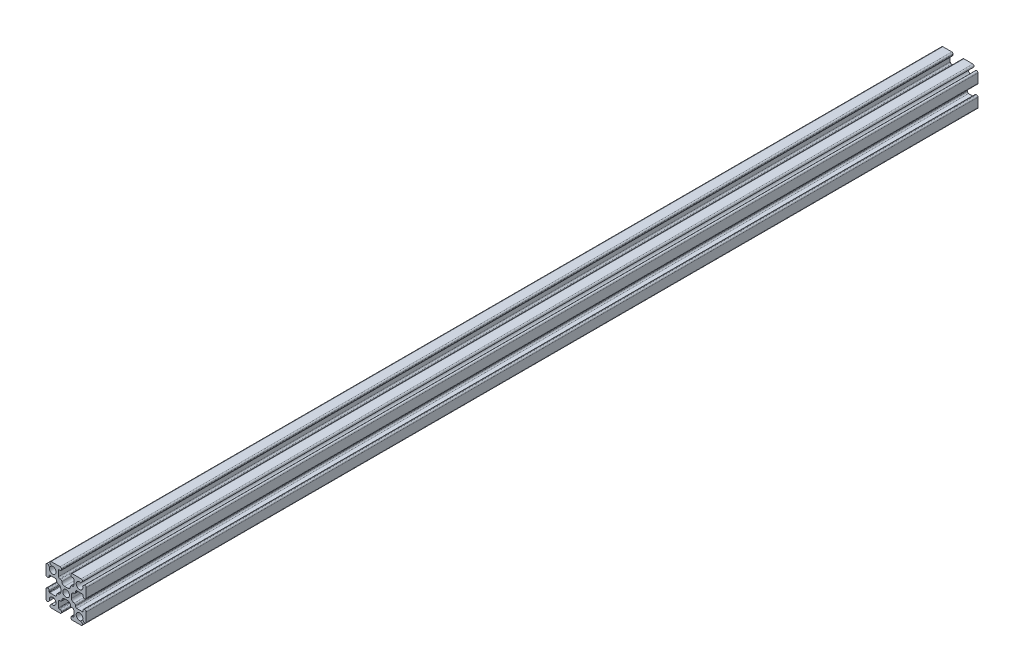
from build123d import *

# Parameters (mm, degrees)
SKETCH1_R           = 1.25
BOSS_EXTRUDE1_DEPTH = 332.35


with BuildPart() as part:
    # Sketch1 → Boss-Extrude1 (new body)
    with BuildSketch(Plane.XY):
        with BuildLine():
            Line((6.646446609, 5.939339828), (6.163645978, 5.456539197))
            ThreePointArc((6.163645978, 5.456539197), (4.116116524, 4.116116524), (5.456539197, 6.163645978))
            Line((5.456539197, 6.163645978), (5.939339828, 6.646446609))
            ThreePointArc((5.939339828, 6.646446609), (6.047726204, 7.191341716), (5.585786438, 7.5))
            Line((5.585786438, 7.5), (2.25, 7.5))
            ThreePointArc((2.25, 7.5), (1.896446609, 7.353553391), (1.75, 7))
            Line((1.75, 7), (1.75, 6.8))
            ThreePointArc((1.75, 6.8), (1.896446609, 6.446446609), (2.25, 6.3))
            Line((2.25, 6.3), (2.65, 6.3))
            ThreePointArc((2.65, 6.3), (2.791421356, 6.241421356), (2.85, 6.1))
            Line((2.85, 6.1), (2.85, 4))
            ThreePointArc((2.85, 4), (2.703553391, 3.646446609), (2.35, 3.5))
            Line((2.35, 3.5), (2.1, 3.5))
            ThreePointArc((2.1, 3.5), (1.746446609, 3.353553391), (1.6, 3))
            ThreePointArc((1.6, 3), (1.307106781, 2.292893219), (0.6, 2))
            Line((0.6, 2), (-0.6, 2))
            ThreePointArc((-0.6, 2), (-1.307106781, 2.292893219), (-1.6, 3))
            ThreePointArc((-1.6, 3), (-1.746446609, 3.353553391), (-2.1, 3.5))
            Line((-2.1, 3.5), (-2.35, 3.5))
            ThreePointArc((-2.35, 3.5), (-2.703553391, 3.646446609), (-2.85, 4))
            Line((-2.85, 4), (-2.85, 6.1))
            ThreePointArc((-2.85, 6.1), (-2.791421356, 6.241421356), (-2.65, 6.3))
            Line((-2.65, 6.3), (-2.25, 6.3))
            ThreePointArc((-2.25, 6.3), (-1.896446609, 6.446446609), (-1.75, 6.8))
            Line((-1.75, 6.8), (-1.75, 7))
            ThreePointArc((-1.75, 7), (-1.896446609, 7.353553391), (-2.25, 7.5))
            Line((-2.25, 7.5), (-5.585786438, 7.5))
            ThreePointArc((-5.585786438, 7.5), (-6.047726204, 7.191341716), (-5.939339828, 6.646446609))
            Line((-5.939339828, 6.646446609), (-5.456539197, 6.163645978))
            ThreePointArc((-5.456539197, 6.163645978), (-4.116116524, 4.116116524), (-6.163645978, 5.456539197))
            Line((-6.163645978, 5.456539197), (-6.646446609, 5.939339828))
            ThreePointArc((-6.646446609, 5.939339828), (-7.191341716, 6.047726204), (-7.5, 5.585786438))
            Line((-7.5, 5.585786438), (-7.5, 2.25))
            ThreePointArc((-7.5, 2.25), (-7.353553391, 1.896446609), (-7, 1.75))
            Line((-7, 1.75), (-6.8, 1.75))
            ThreePointArc((-6.8, 1.75), (-6.446446609, 1.896446609), (-6.3, 2.25))
            Line((-6.3, 2.25), (-6.3, 2.65))
            ThreePointArc((-6.3, 2.65), (-6.241421356, 2.791421356), (-6.1, 2.85))
            Line((-6.1, 2.85), (-4, 2.85))
            ThreePointArc((-4, 2.85), (-3.646446609, 2.703553391), (-3.5, 2.35))
            Line((-3.5, 2.35), (-3.5, 2.1))
            ThreePointArc((-3.5, 2.1), (-3.353553391, 1.746446609), (-3, 1.6))
            ThreePointArc((-3, 1.6), (-2.292893219, 1.307106781), (-2, 0.6))
            Line((-2, 0.6), (-2, -0.6))
            ThreePointArc((-2, -0.6), (-2.292893219, -1.307106781), (-3, -1.6))
            ThreePointArc((-3, -1.6), (-3.353553391, -1.746446609), (-3.5, -2.1))
            Line((-3.5, -2.1), (-3.5, -2.35))
            ThreePointArc((-3.5, -2.35), (-3.646446609, -2.703553391), (-4, -2.85))
            Line((-4, -2.85), (-6.1, -2.85))
            ThreePointArc((-6.1, -2.85), (-6.241421356, -2.791421356), (-6.3, -2.65))
            Line((-6.3, -2.65), (-6.3, -2.25))
            ThreePointArc((-6.3, -2.25), (-6.446446609, -1.896446609), (-6.8, -1.75))
            Line((-6.8, -1.75), (-7, -1.75))
            ThreePointArc((-7, -1.75), (-7.353553391, -1.896446609), (-7.5, -2.25))
            Line((-7.5, -2.25), (-7.5, -5.585786438))
            ThreePointArc((-7.5, -5.585786438), (-7.191341716, -6.047726204), (-6.646446609, -5.939339828))
            Line((-6.646446609, -5.939339828), (-6.163645978, -5.456539197))
            ThreePointArc((-6.163645978, -5.456539197), (-4.116116524, -4.116116524), (-5.456539197, -6.163645978))
            Line((-5.456539197, -6.163645978), (-5.939339828, -6.646446609))
            ThreePointArc((-5.939339828, -6.646446609), (-6.047726204, -7.191341716), (-5.585786438, -7.5))
            Line((-5.585786438, -7.5), (-2.25, -7.5))
            ThreePointArc((-2.25, -7.5), (-1.896446609, -7.353553391), (-1.75, -7))
            Line((-1.75, -7), (-1.75, -6.8))
            ThreePointArc((-1.75, -6.8), (-1.896446609, -6.446446609), (-2.25, -6.3))
            Line((-2.25, -6.3), (-2.65, -6.3))
            ThreePointArc((-2.65, -6.3), (-2.791421356, -6.241421356), (-2.85, -6.1))
            Line((-2.85, -6.1), (-2.85, -4))
            ThreePointArc((-2.85, -4), (-2.703553391, -3.646446609), (-2.35, -3.5))
            Line((-2.35, -3.5), (-2.1, -3.5))
            ThreePointArc((-2.1, -3.5), (-1.746446609, -3.353553391), (-1.6, -3))
            ThreePointArc((-1.6, -3), (-1.307106781, -2.292893219), (-0.6, -2))
            Line((-0.6, -2), (0.6, -2))
            ThreePointArc((0.6, -2), (1.307106781, -2.292893219), (1.6, -3))
            ThreePointArc((1.6, -3), (1.746446609, -3.353553391), (2.1, -3.5))
            Line((2.1, -3.5), (2.35, -3.5))
            ThreePointArc((2.35, -3.5), (2.703553391, -3.646446609), (2.85, -4))
            Line((2.85, -4), (2.85, -6.1))
            ThreePointArc((2.85, -6.1), (2.791421356, -6.241421356), (2.65, -6.3))
            Line((2.65, -6.3), (2.25, -6.3))
            ThreePointArc((2.25, -6.3), (1.896446609, -6.446446609), (1.75, -6.8))
            Line((1.75, -6.8), (1.75, -7))
            ThreePointArc((1.75, -7), (1.896446609, -7.353553391), (2.25, -7.5))
            Line((2.25, -7.5), (5.585786438, -7.5))
            ThreePointArc((5.585786438, -7.5), (6.047726204, -7.191341716), (5.939339828, -6.646446609))
            Line((5.939339828, -6.646446609), (5.456539197, -6.163645978))
            ThreePointArc((5.456539197, -6.163645978), (4.116116524, -4.116116524), (6.163645978, -5.456539197))
            Line((6.163645978, -5.456539197), (6.646446609, -5.939339828))
            ThreePointArc((6.646446609, -5.939339828), (7.191341716, -6.047726204), (7.5, -5.585786438))
            Line((7.5, -5.585786438), (7.5, -2.25))
            ThreePointArc((7.5, -2.25), (7.353553391, -1.896446609), (7, -1.75))
            Line((7, -1.75), (6.8, -1.75))
            ThreePointArc((6.8, -1.75), (6.446446609, -1.896446609), (6.3, -2.25))
            Line((6.3, -2.25), (6.3, -2.65))
            ThreePointArc((6.3, -2.65), (6.241421356, -2.791421356), (6.1, -2.85))
            Line((6.1, -2.85), (4, -2.85))
            ThreePointArc((4, -2.85), (3.646446609, -2.703553391), (3.5, -2.35))
            Line((3.5, -2.35), (3.5, -2.1))
            ThreePointArc((3.5, -2.1), (3.353553391, -1.746446609), (3, -1.6))
            ThreePointArc((3, -1.6), (2.292893219, -1.307106781), (2, -0.6))
            Line((2, -0.6), (2, 0.6))
            ThreePointArc((2, 0.6), (2.292893219, 1.307106781), (3, 1.6))
            ThreePointArc((3, 1.6), (3.353553391, 1.746446609), (3.5, 2.1))
            Line((3.5, 2.1), (3.5, 2.35))
            ThreePointArc((3.5, 2.35), (3.646446609, 2.703553391), (4, 2.85))
            Line((4, 2.85), (6.1, 2.85))
            ThreePointArc((6.1, 2.85), (6.241421356, 2.791421356), (6.3, 2.65))
            Line((6.3, 2.65), (6.3, 2.25))
            ThreePointArc((6.3, 2.25), (6.446446609, 1.896446609), (6.8, 1.75))
            Line((6.8, 1.75), (7, 1.75))
            ThreePointArc((7, 1.75), (7.353553391, 1.896446609), (7.5, 2.25))
            Line((7.5, 2.25), (7.5, 5.585786438))
            ThreePointArc((7.5, 5.585786438), (7.191341716, 6.047726204), (6.646446609, 5.939339828))
        make_face()
        with Locations(Location((0, 0, 0), (0, 0, 180))):
            Circle(SKETCH1_R, mode=Mode.SUBTRACT)
    extrude(amount=BOSS_EXTRUDE1_DEPTH)


solid = part.part
